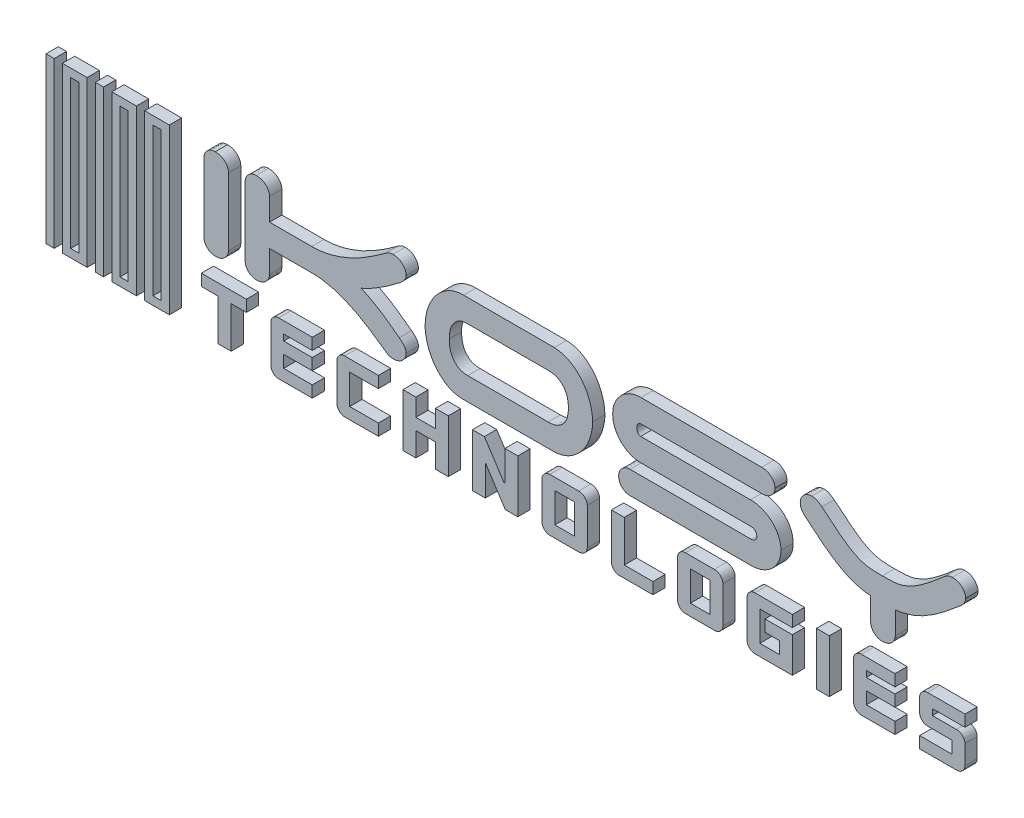
from build123d import *

# Parameters (mm, degrees)
SYMBOL_SKETCH_W        = 1.675
SYMBOL_SKETCH_H        = 33.5
SYMBOL_EXTRUDE_DEPTH   = 2.5
SYMBOL_SKETCH_W_2      = 5.025
SYMBOL_SKETCH_H_2      = 30.15
SYMBOL_EXTRUDE_2_DEPTH = 2.5
SYMBOL_EXTRUDE_3_DEPTH = 2.5
SYMBOL_EXTRUDE_4_DEPTH = 2.5
SYMBOL_EXTRUDE_5_DEPTH = 2.5
TEXT_EXTRUDE_DEPTH     = 2.5
TEXT_EXTRUDE_2_DEPTH   = 2.5
TEXT_EXTRUDE_3_DEPTH   = 2.5
TEXT_EXTRUDE_4_DEPTH   = 2.5
TEXT_EXTRUDE_5_DEPTH   = 2.5
TEXT_EXTRUDE_6_DEPTH   = 2.5
TEXT_EXTRUDE_7_DEPTH   = 2.5
TEXT_EXTRUDE_8_DEPTH   = 2.5
TEXT_EXTRUDE_9_DEPTH   = 2.5
TEXT_EXTRUDE_10_DEPTH  = 2.5
TEXT_SKETCH_W          = 3.996794872
TEXT_SKETCH_H          = 6.064102564
TEXT_EXTRUDE_11_DEPTH  = 2.5
TEXT_EXTRUDE_12_DEPTH  = 2.5
TEXT_EXTRUDE_13_DEPTH  = 2.5
TEXT_EXTRUDE_14_DEPTH  = 2.5
TEXT_SKETCH_W_2        = 2.618589744
TEXT_SKETCH_H_2        = 10.75
TEXT_EXTRUDE_15_DEPTH  = 2.5
TEXT_EXTRUDE_16_DEPTH  = 2.5
TEXT_EXTRUDE_17_DEPTH  = 2.5


with BuildPart() as part:
    # Symbol Sketch → Symbol Extrude (new body)
    with BuildSketch(Plane.XY):
        with Locations((0.8375, 16.75)):
            Rectangle(SYMBOL_SKETCH_W, SYMBOL_SKETCH_H)
    extrude(amount=SYMBOL_EXTRUDE_DEPTH)


with BuildPart() as body_2:
    # Symbol Sketch → Symbol Extrude 2 (new body)
    with BuildSketch(Plane.XY):
        with Locations((5.8625, 16.75)):
            Rectangle(SYMBOL_SKETCH_W_2, SYMBOL_SKETCH_H)
        with Locations((5.8625, 16.75)):
            Rectangle(SYMBOL_SKETCH_W, SYMBOL_SKETCH_H_2, mode=Mode.SUBTRACT)
    extrude(amount=SYMBOL_EXTRUDE_2_DEPTH)


with BuildPart() as body_3:
    # Symbol Sketch → Symbol Extrude 3 (new body)
    with BuildSketch(Plane.XY):
        with Locations((10.8875, 16.75)):
            Rectangle(SYMBOL_SKETCH_W, SYMBOL_SKETCH_H)
    extrude(amount=SYMBOL_EXTRUDE_3_DEPTH)


with BuildPart() as body_4:
    # Symbol Sketch → Symbol Extrude 4 (new body)
    with BuildSketch(Plane.XY):
        with Locations((15.9125, 16.75)):
            Rectangle(SYMBOL_SKETCH_W_2, SYMBOL_SKETCH_H)
        with Locations((15.9125, 16.75)):
            Rectangle(SYMBOL_SKETCH_W, SYMBOL_SKETCH_H_2, mode=Mode.SUBTRACT)
    extrude(amount=SYMBOL_EXTRUDE_4_DEPTH)


with BuildPart() as body_5:
    # Symbol Sketch → Symbol Extrude 5 (new body)
    with BuildSketch(Plane.XY):
        with Locations((22.6125, 16.75)):
            Rectangle(SYMBOL_SKETCH_W_2, SYMBOL_SKETCH_H)
        with Locations((22.6125, 16.75)):
            Rectangle(SYMBOL_SKETCH_W, SYMBOL_SKETCH_H_2, mode=Mode.SUBTRACT)
    extrude(amount=SYMBOL_EXTRUDE_5_DEPTH)


with BuildPart() as body_6:
    # Text Sketch → Text Extrude (new body)
    with BuildSketch(Plane.XY):
        with BuildLine():
            add(Edge.make_bspline(
                [(37.182145172, 17.358903111), (37.172614042, 17.216464941), (37.153507078, 16.930920527), (37.006814698, 16.516172232), (36.772865011, 16.120067652), (36.453812647, 15.752559297), (36.06468528, 15.423409809), (35.590116527, 15.196153881), (35.054726107, 15.055542545), (34.675469577, 15.03902523), (34.47750324, 15.030403435)],
                knots=[0, 0, 0, 0, 0.862232898, 1.728509904, 2.637124992, 3.638458358, 4.667549052, 5.703761565, 6.801397276, 8, 8, 8, 8], degree=3))
            add(Edge.make_bspline(
                [(34.47750324, 15.030403435), (34.31944086, 15.037950422), (34.011904891, 15.052634309), (33.568705895, 15.182300503), (33.171021184, 15.404395227), (32.811828224, 15.693228094), (32.522995357, 16.052421054), (32.300900632, 16.450105765), (32.171234439, 16.893304761), (32.156550552, 17.20084073), (32.149003564, 17.358903111)],
                knots=[0, 0, 0, 0, 1.033498853, 2.010839451, 2.990522858, 4, 5.009477142, 5.989160549, 6.966501147, 8, 8, 8, 8], degree=3))
            Line((32.149003564, 17.358903111), (32.149003564, 31.126903759))
            add(Edge.make_bspline(
                [(32.149003564, 31.126903759), (32.157033893, 31.282851206), (32.172853275, 31.590060602), (32.298078277, 32.032913745), (32.524796911, 32.428618665), (32.81347736, 32.786410354), (33.169018501, 33.081830551), (33.570514074, 33.304574569), (34.014159418, 33.431885187), (34.321492837, 33.447484712), (34.47750324, 33.455403435)],
                knots=[0, 0, 0, 0, 1.021036462, 2.011395514, 2.980149812, 3.990138669, 5.008424466, 5.988604486, 6.978963538, 8, 8, 8, 8], degree=3))
            add(Edge.make_bspline(
                [(34.47750324, 33.455403435), (34.673350927, 33.446429128), (35.050366674, 33.429153176), (35.586176139, 33.291547398), (36.057589653, 33.053363866), (36.453813659, 32.729883836), (36.772620655, 32.359428844), (37.006883894, 31.963745241), (37.152788255, 31.55078682), (37.172420665, 31.267315427), (37.182145172, 31.126903759)],
                knots=[0, 0, 0, 0, 1.187948747, 2.286855633, 3.329671233, 4.369332619, 5.371825634, 6.281492993, 7.148773238, 8, 8, 8, 8], degree=3))
            Line((37.182145172, 31.126903759), (37.182145172, 17.358903111))
        make_face()
    extrude(amount=TEXT_EXTRUDE_DEPTH)


with BuildPart() as body_7:
    # Text Sketch → Text Extrude 2 (new body)
    with BuildSketch(Plane.XY):
        with BuildLine():
            Line((45.552802981, 26.571403111), (54.144369734, 26.571403111))
            add(Edge.make_bspline(
                [(54.144369734, 26.571403111), (54.486859765, 26.579352598), (55.16914667, 26.595189063), (56.187147227, 26.690022319), (57.189333875, 26.859879412), (58.514327124, 27.164788101), (60.147453942, 27.698179783), (62.071811851, 28.488227135), (63.93251169, 29.435053601), (65.711254445, 30.500703399), (67.412352307, 31.628130344), (68.509760547, 32.415193234), (69.052738172, 32.804617628)],
                knots=[0, 0, 0, 0, 0.625370962, 1.245824342, 1.864700964, 2.479950729, 3.726807079, 4.996086198, 6.27499779, 7.534434493, 8.780083059, 10, 10, 10, 10], degree=3))
            add(Edge.make_bspline(
                [(69.052738172, 32.804617628), (69.180924828, 32.905013993), (69.428529436, 33.098939036), (69.838818131, 33.301070223), (70.253097409, 33.429576829), (70.532544055, 33.446857248), (70.670746922, 33.455403435)],
                knots=[0, 0, 0, 0, 1.095900439, 2.116834999, 3.068663713, 4, 4, 4, 4], degree=3))
            add(Edge.make_bspline(
                [(70.670746922, 33.455403435), (70.866647718, 33.446658037), (71.241838803, 33.429908768), (71.775130836, 33.290324316), (72.244740749, 33.053375031), (72.641616114, 32.730176752), (72.958710831, 32.357563257), (73.201237776, 31.965573734), (73.345684871, 31.550581006), (73.365549381, 31.267247251), (73.375388853, 31.126903759)],
                knots=[0, 0, 0, 0, 1.188770155, 2.27674401, 3.320280665, 4.360660926, 5.363847116, 6.280304729, 7.148184656, 8, 8, 8, 8], degree=3))
            add(Edge.make_bspline(
                [(73.375388853, 31.126903759), (73.37089662, 31.030915742), (73.361970624, 30.840189062), (73.286709068, 30.561340692), (73.164457735, 30.293885233), (72.931849333, 29.94501161), (72.542002315, 29.521037526), (72.170230435, 29.232578593), (71.972318535, 29.079018146)],
                knots=[0, 0, 0, 0, 0.669693301, 1.330670049, 2.00266867, 2.716108566, 4.251827991, 6, 6, 6, 6], degree=3))
            add(Edge.make_bspline(
                [(71.972318535, 29.079018146), (71.634884641, 28.819126035), (70.986192283, 28.31950217), (70.021608464, 27.606770011), (69.065549149, 26.944452694), (68.086164671, 26.300465206), (67.044824961, 25.683270782), (66.159618942, 25.170630259), (65.450425207, 24.8004343), (64.963060142, 24.561872254), (64.520039702, 24.377123432), (64.235053276, 24.281281235), (64.103183733, 24.236932923)],
                knots=[0, 0, 0, 0, 1.377873125, 2.648861836, 3.879417678, 5.140173149, 6.439784966, 7.794983305, 8.44869275, 9.027502601, 9.550003875, 10, 10, 10, 10], degree=3))
            add(Edge.make_bspline(
                [(64.103183733, 24.236932923), (64.426346781, 24.115830526), (65.094021845, 23.865625402), (66.067574581, 23.35696038), (67.062537349, 22.791904628), (68.06629702, 22.188119935), (69.0489301, 21.550166516), (70.007726675, 20.872192439), (70.976462382, 20.156053887), (71.628687404, 19.658437208), (71.966348023, 19.400818211)],
                knots=[0, 0, 0, 0, 0.89323937, 1.845488394, 2.840530647, 3.858234817, 4.879263654, 5.87478663, 6.899764902, 8, 8, 8, 8], degree=3))
            add(Edge.make_bspline(
                [(71.966348023, 19.400818211), (72.166585933, 19.245454257), (72.543003808, 18.95339283), (72.932133926, 18.524661686), (73.171708237, 18.181767786), (73.286316603, 17.915397621), (73.361701204, 17.641714314), (73.370838187, 17.452927967), (73.375388853, 17.358903111)],
                knots=[0, 0, 0, 0, 1.769110466, 3.325667981, 4.028039365, 4.68216811, 5.343655115, 6, 6, 6, 6], degree=3))
            add(Edge.make_bspline(
                [(73.375388853, 17.358903111), (73.365854065, 17.216469479), (73.34673977, 16.930934162), (73.200103478, 16.516116278), (72.965922621, 16.120298508), (72.646824317, 15.750413997), (72.25242558, 15.425252855), (71.77765472, 15.195819855), (71.243861358, 15.056153822), (70.866680419, 15.039206848), (70.670746922, 15.030403435)],
                knots=[0, 0, 0, 0, 0.862519697, 1.729084847, 2.638002162, 3.639668596, 4.678472755, 5.715029937, 6.813030747, 8, 8, 8, 8], degree=3))
            add(Edge.make_bspline(
                [(70.670746922, 15.030403435), (70.532519538, 15.038899076), (70.253023319, 15.05607729), (69.841696478, 15.18458098), (69.434489931, 15.380427022), (69.190846876, 15.570711597), (69.064679196, 15.669248218)],
                knots=[0, 0, 0, 0, 0.939973017, 1.900628496, 2.912865253, 4, 4, 4, 4], degree=3))
            add(Edge.make_bspline(
                [(69.064679196, 15.669248218), (68.509996443, 16.068968023), (67.393710081, 16.873394992), (65.667835584, 18.016151854), (63.89340991, 19.091271258), (62.356363003, 19.877937945), (61.098353336, 20.427962037), (60.142058009, 20.797968314), (59.173292424, 21.12913809), (58.189140829, 21.40894719), (57.193794985, 21.639448918), (56.186095774, 21.797303185), (55.169730959, 21.90665734), (54.486969658, 21.915791087), (54.144369734, 21.920374271)],
                knots=[0, 0, 0, 0, 1.495432356, 3.00952343, 4.526603086, 6.031585771, 6.782144813, 7.529147792, 8.273927562, 9.020803678, 9.766397276, 10.507145663, 11.250906896, 12, 12, 12, 12], degree=3))
            Line((54.144369734, 21.920374271), (45.552802981, 21.920374271))
            Line((45.552802981, 21.920374271), (45.552802981, 17.358903111))
            add(Edge.make_bspline(
                [(45.552802981, 17.358903111), (45.543271477, 17.216465609), (45.524163762, 16.930922534), (45.377477128, 16.516163996), (45.143503758, 16.12010163), (44.824550559, 15.752416518), (44.436407817, 15.425116475), (43.968809015, 15.197115476), (43.445443175, 15.055875135), (43.075994082, 15.039114346), (42.883984122, 15.030403435)],
                knots=[0, 0, 0, 0, 0.869868558, 1.743817038, 2.660478533, 3.670679389, 4.708883383, 5.743368767, 6.827184362, 8, 8, 8, 8], degree=3))
            add(Edge.make_bspline(
                [(42.883984122, 15.030403435), (42.725921741, 15.037950422), (42.418385772, 15.052634309), (41.975186776, 15.182300503), (41.577502065, 15.404395227), (41.218309105, 15.693228094), (40.929476238, 16.052421054), (40.707381514, 16.450105765), (40.57771532, 16.893304761), (40.563031433, 17.20084073), (40.555484446, 17.358903111)],
                knots=[0, 0, 0, 0, 1.033498853, 2.010839451, 2.990522858, 4, 5.009477142, 5.989160549, 6.966501147, 8, 8, 8, 8], degree=3))
            Line((40.555484446, 17.358903111), (40.555484446, 31.126903759))
            add(Edge.make_bspline(
                [(40.555484446, 31.126903759), (40.563515377, 31.282850394), (40.579335946, 31.59005819), (40.704552313, 32.032922971), (40.931303311, 32.42858427), (41.219858014, 32.786545445), (41.574518307, 33.080210928), (41.967503069, 33.301946414), (42.396284047, 33.432256679), (42.692064386, 33.447610471), (42.842190538, 33.455403435)],
                knots=[0, 0, 0, 0, 1.03238026, 2.033742283, 3.013259521, 4.034469437, 5.064068473, 6.043585711, 7.007003139, 8, 8, 8, 8], degree=3))
            add(Edge.make_bspline(
                [(42.842190538, 33.455403435), (43.038034287, 33.446426788), (43.415042456, 33.429146333), (43.950904615, 33.291571865), (44.422131128, 33.053277221), (44.819036365, 32.730201967), (45.136123497, 32.357557234), (45.378652257, 31.965575188), (45.523098915, 31.550580659), (45.542963481, 31.267247136), (45.552802981, 31.126903759)],
                knots=[0, 0, 0, 0, 1.187035174, 2.285096964, 3.327110603, 4.365972454, 5.367694518, 6.282814583, 7.14942786, 8, 8, 8, 8], degree=3))
            Line((45.552802981, 31.126903759), (45.552802981, 26.571403111))
        make_face()
    extrude(amount=TEXT_EXTRUDE_2_DEPTH)


with BuildPart() as body_8:
    # Text Sketch → Text Extrude 3 (new body)
    with BuildSketch(Plane.XY):
        with BuildLine():
            add(Edge.make_bspline(
                [(111.353815619, 24.242903435), (111.348994555, 23.989778597), (111.33923799, 23.477520473), (111.228605779, 22.705852479), (111.069846709, 21.920927302), (110.842341935, 21.133126299), (110.55966344, 20.35213342), (110.207211048, 19.598063398), (109.783786331, 18.877342161), (109.304542305, 18.187440879), (108.760051664, 17.538777697), (108.147582965, 16.945018374), (107.468407849, 16.407346485), (106.73395845, 15.920657099), (105.928457415, 15.521781024), (105.055362662, 15.232853389), (104.115937433, 15.065943879), (103.469420637, 15.042438605), (103.138391121, 15.030403435)],
                knots=[0, 0, 0, 0, 0.887562666, 1.79619349, 2.730230654, 3.696171481, 4.670456872, 5.642035631, 6.612182846, 7.600186341, 8.58641134, 9.579043665, 10.587854658, 11.622157229, 12.665262734, 13.731876165, 14.838675282, 16, 16, 16, 16], degree=3))
            Line((103.138391121, 15.030403435), (84.659656513, 15.030403435))
            add(Edge.make_bspline(
                [(84.659656513, 15.030403435), (84.370080298, 15.055027634), (83.803167744, 15.10323521), (82.983046752, 15.29698083), (82.217087831, 15.592736658), (81.505416533, 15.982920524), (80.85142467, 16.454360111), (80.236876696, 16.972404366), (79.683625026, 17.554728526), (79.179101432, 18.183241115), (78.733864736, 18.859069759), (78.338187379, 19.568602332), (78.00500702, 20.313106591), (77.722482484, 21.07984952), (77.510066763, 21.868017553), (77.356108133, 22.660147191), (77.254026262, 23.452144023), (77.243537332, 23.979895365), (77.23831011, 24.242903435)],
                knots=[0, 0, 0, 0, 1.071895832, 2.098484516, 3.098701618, 4.095024705, 5.085859565, 6.070929021, 7.058325083, 8.046349754, 9.042889575, 10.042755757, 11.042486936, 12.051303591, 13.056635549, 14.052389487, 15.029396535, 16, 16, 16, 16], degree=3))
            add(Edge.make_bspline(
                [(77.23831011, 24.242903435), (77.246453928, 24.509799624), (77.26285149, 25.047194639), (77.357152996, 25.853067742), (77.530494058, 26.657524075), (77.754264709, 27.461021805), (78.041391065, 28.250776499), (78.406734369, 29.004886724), (78.815846808, 29.732279712), (79.294021656, 30.417508049), (79.829761356, 31.056781891), (80.423896669, 31.638337532), (81.070278769, 32.160544264), (81.770884139, 32.615050122), (82.519626885, 32.999506534), (83.330933658, 33.257743163), (84.184941379, 33.426835259), (84.772259541, 33.445758207), (85.071621841, 33.455403435)],
                knots=[0, 0, 0, 0, 0.957572403, 1.928070379, 2.905345163, 3.906550234, 4.91841359, 5.914694441, 6.909080783, 7.909165367, 8.907311603, 9.896765544, 10.886811641, 11.882811104, 12.888485635, 13.895350359, 14.927237742, 16, 16, 16, 16], degree=3))
            Line((85.071621841, 33.455403435), (103.562297472, 33.449432923))
            add(Edge.make_bspline(
                [(103.562297472, 33.449432923), (103.881834833, 33.423539771), (104.504881866, 33.373052242), (105.404007255, 33.16528616), (106.241004153, 32.858985534), (106.999552828, 32.430566938), (107.695481955, 31.94159588), (108.334492434, 31.401229995), (108.908739995, 30.807898158), (109.421435647, 30.168222415), (109.875003555, 29.492207648), (110.272685041, 28.787236437), (110.59793102, 28.048696915), (110.873728828, 27.293325569), (111.086156998, 26.526113324), (111.244136509, 25.76066809), (111.335848702, 24.999435914), (111.347854751, 24.493897545), (111.353815619, 24.242903435)],
                knots=[0, 0, 0, 0, 1.15756904, 2.257075526, 3.324770562, 4.368045022, 5.395925654, 6.396323121, 7.388434129, 8.376048353, 9.355769955, 10.328466472, 11.297804901, 12.26956978, 13.233097401, 14.172774794, 15.092803254, 16, 16, 16, 16], degree=3))
        make_face()
        with BuildLine():
            add(Edge.make_bspline(
                [(102.290578419, 19.681432275), (102.493897065, 19.687081139), (102.882489858, 19.697877533), (103.43802075, 19.781466029), (103.936814716, 19.919738736), (104.373442017, 20.128626023), (104.752358622, 20.377693027), (105.099516883, 20.637082516), (105.3926992, 20.933937178), (105.729176496, 21.357821947), (106.058926063, 21.955236526), (106.279282317, 22.735352924), (106.412093607, 23.501905951), (106.431120372, 24.005602281), (106.440084251, 24.242903435)],
                knots=[0, 0, 0, 0, 1.046644794, 2.000400019, 2.885908836, 3.701969816, 4.480954947, 5.218948154, 5.92916188, 6.622234248, 8.002950174, 9.406752558, 10.778270606, 12, 12, 12, 12], degree=3))
            add(Edge.make_bspline(
                [(106.440084251, 24.242903435), (106.431274628, 24.480249801), (106.412648178, 24.982078326), (106.277885498, 25.745942577), (106.061647688, 26.524420867), (105.723946787, 27.116050185), (105.395204484, 27.548008061), (105.09133427, 27.840086005), (104.748840838, 28.109046486), (104.365885942, 28.358473533), (103.927889717, 28.563462087), (103.430461639, 28.705602039), (102.878403665, 28.787344971), (102.491871168, 28.798543032), (102.290578419, 28.804374595)],
                knots=[0, 0, 0, 0, 1.222567146, 2.584910299, 3.989675285, 5.362363695, 6.06397828, 6.781967681, 7.526778103, 8.306297391, 9.132203488, 10.00847181, 10.962881034, 12, 12, 12, 12], degree=3))
            Line((102.290578419, 28.804374595), (85.925405055, 28.804374595))
            add(Edge.make_bspline(
                [(85.925405055, 28.804374595), (85.747937462, 28.800752617), (85.407052429, 28.793795413), (84.924107929, 28.715025615), (84.490000806, 28.592278181), (83.994603668, 28.352511717), (83.456936937, 27.9519452), (82.931172218, 27.350128412), (82.547137346, 26.631220865), (82.30673027, 25.842580808), (82.178941369, 25.037289462), (82.160815651, 24.502015283), (82.152041478, 24.242903435)],
                knots=[0, 0, 0, 0, 0.794200639, 1.525524215, 2.185566194, 2.807611374, 3.980821995, 5.16243582, 6.359119684, 7.602475229, 8.839422673, 10, 10, 10, 10], degree=3))
            add(Edge.make_bspline(
                [(82.152041478, 24.242903435), (82.160672361, 23.981755998), (82.178497016, 23.442429643), (82.308136414, 22.63447879), (82.538564784, 21.840088861), (82.930517926, 21.125383855), (83.458600434, 20.530468803), (83.986550278, 20.125748608), (84.482707834, 19.8924747), (84.916311803, 19.771535944), (85.403033754, 19.691567634), (85.745934168, 19.684914476), (85.925405055, 19.681432275)],
                knots=[0, 0, 0, 0, 1.168189698, 2.412566253, 3.651898492, 4.851533932, 6.025141351, 7.189898139, 7.799403787, 8.467261891, 9.19777913, 10, 10, 10, 10], degree=3))
            Line((85.925405055, 19.681432275), (102.290578419, 19.681432275))
        make_face(mode=Mode.SUBTRACT)
    extrude(amount=TEXT_EXTRUDE_3_DEPTH)


with BuildPart() as body_9:
    # Text Sketch → Text Extrude 4 (new body)
    with BuildSketch(Plane.XY):
        with BuildLine():
            add(Edge.make_bspline(
                [(121.217101426, 21.920374271), (121.017826032, 21.926573655), (120.623494254, 21.93884117), (120.042509249, 22.022488617), (119.485047021, 22.16752527), (118.950181195, 22.364296202), (118.447637637, 22.61658068), (117.970921592, 22.901670476), (117.535465013, 23.235000758), (117.124989484, 23.595776911), (116.764213331, 24.00625244), (116.430883049, 24.441709019), (116.145793252, 24.918425065), (115.893508775, 25.420968622), (115.696737843, 25.955834449), (115.55170119, 26.513296677), (115.468053743, 27.094281681), (115.455786228, 27.488613459), (115.449586844, 27.687888853)],
                knots=[0, 0, 0, 0, 1.055198062, 2.088055732, 3.10027589, 4.100630988, 5.099819621, 6.074018954, 7.037268981, 8, 8.962731019, 9.925981046, 10.900180379, 11.899369012, 12.89972411, 13.911944268, 14.944801938, 16, 16, 16, 16], degree=3))
            add(Edge.make_bspline(
                [(115.449586844, 27.687888853), (115.455793792, 27.887167824), (115.468076278, 28.281506681), (115.551339136, 28.860528318), (115.696155917, 29.417058901), (115.900978508, 29.947506801), (116.151267048, 30.451594027), (116.437073415, 30.927939183), (116.769793903, 31.363978979), (117.133188602, 31.773490725), (117.539668408, 32.143366911), (117.982857304, 32.471330903), (118.457558828, 32.761175179), (118.966635677, 33.003921897), (119.498103026, 33.208143698), (120.054512167, 33.35300862), (120.629405186, 33.437012652), (121.019802299, 33.449229352), (121.217101426, 33.455403435)],
                knots=[0, 0, 0, 0, 1.056069126, 2.089779418, 3.092625705, 4.097522181, 5.097535642, 6.072539174, 7.036584362, 8.000110114, 8.970710769, 9.943200813, 10.918204345, 11.913590283, 12.928346752, 13.931193039, 14.954465097, 16, 16, 16, 16], degree=3))
            Line((121.217101426, 33.455403435), (145.803669799, 33.455403435))
            add(Edge.make_bspline(
                [(145.803669799, 33.455403435), (145.999513548, 33.446426788), (146.376521717, 33.429146333), (146.912383876, 33.291571865), (147.383610389, 33.053277221), (147.780515626, 32.730201967), (148.097602758, 32.357557234), (148.340131519, 31.965575188), (148.484578177, 31.550580659), (148.504442742, 31.267247136), (148.514282242, 31.126903759)],
                knots=[0, 0, 0, 0, 1.187035174, 2.285096964, 3.327110603, 4.365972454, 5.367694518, 6.282814583, 7.14942786, 8, 8, 8, 8], degree=3))
            add(Edge.make_bspline(
                [(148.514282242, 31.126903759), (148.504558795, 30.986489983), (148.484928523, 30.703014335), (148.339007628, 30.290088822), (148.104812725, 29.894269206), (147.78571872, 29.524385466), (147.391318469, 29.199223258), (146.916549111, 28.969793784), (146.380817234, 28.829607633), (146.001610265, 28.813028604), (145.803669799, 28.804374595)],
                knots=[0, 0, 0, 0, 0.850520932, 1.717082035, 2.625995105, 3.627656861, 4.666456168, 5.70300851, 6.801004192, 8, 8, 8, 8], degree=3))
            Line((145.803669799, 28.804374595), (121.13948477, 28.804374595))
            add(Edge.make_bspline(
                [(121.13948477, 28.804374595), (121.063693239, 28.787232398), (120.87716047, 28.745043232), (120.679143648, 28.572383553), (120.512655636, 28.388264225), (120.425018573, 28.188359985), (120.371513826, 27.951504313), (120.366175554, 27.779796523), (120.363318211, 27.687888853)],
                knots=[0, 0, 0, 0, 0.929705688, 2.288126067, 3.074503345, 3.925707183, 4.889721779, 6, 6, 6, 6], degree=3))
            add(Edge.make_bspline(
                [(120.363318211, 27.687888853), (120.366153737, 27.599925916), (120.371500042, 27.434074209), (120.427186883, 27.201978296), (120.512629401, 27.000174212), (120.676348787, 26.808642274), (120.878647155, 26.638903106), (121.063879252, 26.590968434), (121.13948477, 26.571403111)],
                knots=[0, 0, 0, 0, 1.066464062, 2.010788751, 2.887353709, 3.695542847, 5.059398025, 6, 6, 6, 6], degree=3))
            Line((121.13948477, 26.571403111), (143.534875243, 26.571403111))
            add(Edge.make_bspline(
                [(143.534875243, 26.571403111), (143.756126286, 26.566172652), (144.19477772, 26.555802766), (144.841380853, 26.457561896), (145.465157032, 26.295924503), (146.061017763, 26.073018293), (146.62304302, 25.808547849), (147.14309044, 25.50100522), (147.615254622, 25.155130974), (148.039814034, 24.771663946), (148.420686172, 24.356374178), (148.751954281, 23.907479368), (149.050968925, 23.433915297), (149.2907417, 22.926914162), (149.49054355, 22.405214304), (149.62771894, 21.866203761), (149.71373728, 21.318134257), (149.726088556, 20.947491275), (149.732266688, 20.762094945)],
                knots=[0, 0, 0, 0, 1.125524374, 2.23146012, 3.319860629, 4.399933111, 5.464745038, 6.47755185, 7.470303123, 8.438566666, 9.385019312, 10.333150884, 11.274821239, 12.230766696, 13.182786281, 14.113937299, 15.056587825, 16, 16, 16, 16], degree=3))
            add(Edge.make_bspline(
                [(149.732266688, 20.762094945), (149.725923937, 20.576742819), (149.713243556, 20.206188208), (149.629605245, 19.656955325), (149.483407915, 19.121767761), (149.287020814, 18.604077115), (149.041235887, 18.106108959), (148.748297006, 17.635006737), (148.410952166, 17.18891237), (148.029724109, 16.772795673), (147.607654595, 16.387604283), (147.132159818, 16.053375097), (146.621510524, 15.744487552), (146.060088344, 15.494245829), (145.469996632, 15.278470321), (144.845188683, 15.14167754), (144.198543357, 15.046281326), (143.758139085, 15.035744898), (143.534875243, 15.030403435)],
                knots=[0, 0, 0, 0, 0.947658347, 1.894551617, 2.832491261, 3.779275183, 4.721235255, 5.667143943, 6.611409382, 7.57649714, 8.549118708, 9.52614791, 10.54351323, 11.595303979, 12.663746289, 13.749776913, 14.859244828, 16, 16, 16, 16], degree=3))
            Line((143.534875243, 15.030403435), (118.990100454, 15.030403435))
            add(Edge.make_bspline(
                [(118.990100454, 15.030403435), (118.83404776, 15.038114315), (118.528545022, 15.053209824), (118.08727467, 15.182297149), (117.689588618, 15.404396157), (117.330396028, 15.693227841), (117.041563061, 16.05242112), (116.819468363, 16.450105748), (116.689802162, 16.893304766), (116.675118277, 17.200840732), (116.66757129, 17.358903111)],
                knots=[0, 0, 0, 0, 1.022177595, 2.001106468, 2.982381959, 3.993499602, 5.004617245, 5.985892735, 6.964821609, 8, 8, 8, 8], degree=3))
            add(Edge.make_bspline(
                [(116.66757129, 17.358903111), (116.675608371, 17.514842559), (116.691441055, 17.822036197), (116.816569286, 18.265003974), (117.04365064, 18.660279222), (117.330126494, 19.018745232), (117.689658444, 19.307403967), (118.087256362, 19.529547891), (118.528549831, 19.658623434), (118.834049386, 19.673720566), (118.990100454, 19.681432275)],
                knots=[0, 0, 0, 0, 1.023700639, 2.016643822, 2.987925878, 4.000550086, 5.013174293, 5.995911884, 6.976299361, 8, 8, 8, 8], degree=3))
            Line((118.990100454, 19.681432275), (143.702049579, 19.681432275))
            add(Edge.make_bspline(
                [(143.702049579, 19.681432275), (143.845308378, 19.695480381), (144.135343765, 19.72392155), (144.439737596, 19.943027008), (144.639034421, 20.155666708), (144.738466705, 20.34718427), (144.812474746, 20.547704917), (144.816489843, 20.689737111), (144.818535321, 20.762094945)],
                knots=[0, 0, 0, 0, 1.483557837, 3.00354516, 3.785710979, 4.522423995, 5.247253764, 6, 6, 6, 6], degree=3))
            add(Edge.make_bspline(
                [(144.818535321, 20.762094945), (144.813347173, 20.840084756), (144.803341951, 20.99048629), (144.742049242, 21.209432237), (144.631949002, 21.407762196), (144.483271931, 21.582857523), (144.312190937, 21.733687581), (144.121302125, 21.84234404), (143.914763601, 21.904847666), (143.774107867, 21.91511453), (143.702049579, 21.920374271)],
                knots=[0, 0, 0, 0, 1.052637569, 2.029987015, 3.039270143, 4.08779047, 5.115827877, 6.101623483, 7.027456916, 8, 8, 8, 8], degree=3))
            Line((143.702049579, 21.920374271), (121.217101426, 21.920374271))
        make_face()
    extrude(amount=TEXT_EXTRUDE_4_DEPTH)


with BuildPart() as body_10:
    # Text Sketch → Text Extrude 5 (new body)
    with BuildSketch(Plane.XY):
        with BuildLine():
            add(Edge.make_bspline(
                [(173.035174984, 17.358903111), (173.025640196, 17.216469478), (173.0065259, 16.930934159), (172.859889613, 16.516116288), (172.625708737, 16.120298463), (172.306610511, 15.750414184), (171.912211468, 15.425252131), (171.437441779, 15.195822615), (170.901709996, 15.055636476), (170.522503014, 15.039057445), (170.324562541, 15.030403435)],
                knots=[0, 0, 0, 0, 0.861224399, 1.726488175, 2.634040514, 3.634202684, 4.671446808, 5.70644733, 6.802799205, 8, 8, 8, 8], degree=3))
            add(Edge.make_bspline(
                [(170.324562541, 15.030403435), (170.168509847, 15.038114315), (169.863007109, 15.053209824), (169.421736757, 15.182297149), (169.024050705, 15.404396157), (168.664858115, 15.693227841), (168.376025148, 16.05242112), (168.15393045, 16.450105748), (168.024264249, 16.893304766), (168.009580363, 17.200840732), (168.002033377, 17.358903111)],
                knots=[0, 0, 0, 0, 1.022177595, 2.001106468, 2.982381959, 3.993499602, 5.004617245, 5.985892735, 6.964821609, 8, 8, 8, 8], degree=3))
            Line((168.002033377, 17.358903111), (168.002033377, 21.920374271))
            add(Edge.make_bspline(
                [(168.002033377, 21.920374271), (167.792760822, 21.924234631), (167.358690089, 21.932241745), (166.693951576, 22.026401774), (165.98853887, 22.147315269), (165.255219937, 22.334183228), (164.496085879, 22.574044372), (163.719376603, 22.865858209), (162.930287482, 23.219665537), (162.127625079, 23.636557884), (161.298511011, 24.108728965), (160.451357226, 24.654830958), (159.566106751, 25.253466698), (158.65517876, 25.924684194), (157.700120482, 26.663847072), (156.699447625, 27.477156146), (155.642084547, 28.360337465), (154.925658489, 28.980380854), (154.556440376, 29.29992709)],
                knots=[0, 0, 0, 0, 0.641398825, 1.330382084, 2.055978345, 2.836185825, 3.648952849, 4.496988013, 5.379557769, 6.299582378, 7.270216231, 8.304862195, 9.390111043, 10.547532482, 11.774599775, 13.093996411, 14.502358824, 16, 16, 16, 16], degree=3))
            add(Edge.make_bspline(
                [(154.556440376, 29.29992709), (154.439006949, 29.417957817), (154.197903315, 29.660287775), (153.907981861, 30.093712509), (153.697031447, 30.589995479), (153.672935578, 30.947696162), (153.660863577, 31.126903759)],
                knots=[0, 0, 0, 0, 0.953032214, 1.956679093, 2.976298768, 4, 4, 4, 4], degree=3))
            add(Edge.make_bspline(
                [(153.660863577, 31.126903759), (153.668893906, 31.282851206), (153.684713288, 31.590060602), (153.80993829, 32.032913745), (154.036656924, 32.428618665), (154.325337373, 32.786410354), (154.680878514, 33.081830551), (155.082374087, 33.304574569), (155.526019431, 33.431885187), (155.83335285, 33.447484712), (155.989363253, 33.455403435)],
                knots=[0, 0, 0, 0, 1.021036462, 2.011395514, 2.980149812, 3.990138669, 5.008424466, 5.988604486, 6.978963538, 8, 8, 8, 8], degree=3))
            add(Edge.make_bspline(
                [(155.989363253, 33.455403435), (156.187832621, 33.449933525), (156.548072053, 33.440005156), (156.972175862, 33.30121232), (157.26629083, 33.140651276), (157.508928188, 32.994562647), (157.780836701, 32.815999418), (157.971877452, 32.683661028), (158.073071938, 32.613561244)],
                knots=[0, 0, 0, 0, 1.550277569, 2.813890719, 3.449254088, 4.17735297, 5.034541965, 6, 6, 6, 6], degree=3))
            add(Edge.make_bspline(
                [(158.073071938, 32.613561244), (158.482045349, 32.260128564), (159.257722684, 31.589792275), (160.372311852, 30.657741649), (161.374057841, 29.855368451), (162.275918389, 29.176315012), (163.096766108, 28.597090968), (163.86431779, 28.116740563), (164.57927606, 27.709748785), (165.250940376, 27.382935749), (165.895843149, 27.130474893), (166.512143554, 26.924442588), (167.113612145, 26.779853955), (167.707209892, 26.689128272), (168.314063058, 26.641058114), (168.956736442, 26.596293988), (169.645749284, 26.573551995), (170.121553079, 26.572133125), (170.366356124, 26.571403111)],
                knots=[0, 0, 0, 0, 1.836146017, 3.482516976, 4.935327597, 6.195494878, 7.317033276, 8.346813987, 9.270068544, 10.110663513, 10.881484832, 11.621201485, 12.31645431, 12.980022201, 13.658809721, 14.383734916, 15.168424845, 16, 16, 16, 16], degree=3))
            add(Edge.make_bspline(
                [(170.366356124, 26.571403111), (170.623108675, 26.571924823), (171.118826281, 26.572932104), (171.83545423, 26.598139987), (172.49617539, 26.634705581), (173.11730106, 26.676016131), (173.720371073, 26.768587398), (174.334951806, 26.910989979), (174.966466722, 27.126208002), (175.631025619, 27.389019775), (176.329060199, 27.728678289), (177.067012835, 28.148140943), (177.849359752, 28.648072664), (178.532906471, 29.116472519), (179.106577477, 29.546873411), (179.580123331, 29.904684064), (180.083856503, 30.300632133), (180.614126392, 30.734362083), (181.18196383, 31.194540784), (181.770645886, 31.699369852), (182.395683531, 32.232269952), (182.819273708, 32.603123116), (183.035782566, 32.792676604)],
                knots=[0, 0, 0, 0, 1.057356201, 2.041460081, 2.952579034, 3.782999482, 4.603695654, 5.462550415, 6.377495452, 7.348542422, 8.404309042, 9.571413422, 10.842502825, 12.227097685, 12.982804895, 13.795894059, 14.67148133, 15.621299327, 16.617244161, 17.6814085, 18.81490264, 20, 20, 20, 20], degree=3))
            add(Edge.make_bspline(
                [(183.035782566, 32.792676604), (183.167881956, 32.895299245), (183.419804726, 33.091007794), (183.834862955, 33.293366879), (184.246999843, 33.431259762), (184.527361662, 33.447425128), (184.66573234, 33.455403435)],
                knots=[0, 0, 0, 0, 1.116180587, 2.128634399, 3.076400182, 4, 4, 4, 4], degree=3))
            add(Edge.make_bspline(
                [(184.66573234, 33.455403435), (184.861576089, 33.446426788), (185.238584257, 33.429146333), (185.774446416, 33.291571865), (186.24567293, 33.053277221), (186.642578166, 32.730201967), (186.959665298, 32.357557234), (187.202194059, 31.965575188), (187.346640717, 31.550580659), (187.366505283, 31.267247136), (187.376344783, 31.126903759)],
                knots=[0, 0, 0, 0, 1.187035174, 2.285096964, 3.327110603, 4.365972454, 5.367694518, 6.282814583, 7.14942786, 8, 8, 8, 8], degree=3))
            add(Edge.make_bspline(
                [(187.376344783, 31.126903759), (187.364715549, 30.973810257), (187.340436146, 30.654183114), (187.130819259, 30.18644629), (186.797446326, 29.722883595), (186.502401018, 29.44801289), (186.343446209, 29.29992709)],
                knots=[0, 0, 0, 0, 0.846631323, 1.767588747, 2.797294875, 4, 4, 4, 4], degree=3))
            add(Edge.make_bspline(
                [(186.343446209, 29.29992709), (185.999699879, 29.004744277), (185.323641622, 28.424197633), (184.317906281, 27.5795757), (183.324588339, 26.794338226), (182.361930297, 26.05141617), (181.418075082, 25.373551802), (180.508072074, 24.747142594), (179.613987456, 24.19941229), (178.749203755, 23.704631135), (177.898710578, 23.281332823), (177.065617155, 22.911935639), (176.240776845, 22.608950689), (175.443027531, 22.361815765), (174.702105733, 22.175164371), (174.053150446, 22.036867305), (173.509367899, 21.944649463), (173.180709121, 21.927824549), (173.035174984, 21.920374271)],
                knots=[0, 0, 0, 0, 1.405337354, 2.763927467, 4.073070632, 5.332368463, 6.535021961, 7.676977369, 8.757910683, 9.786166288, 10.766154311, 11.703149807, 12.611296932, 13.489908946, 14.292364098, 14.980007543, 15.548334831, 16, 16, 16, 16], degree=3))
            Line((173.035174984, 21.920374271), (173.035174984, 17.358903111))
        make_face()
    extrude(amount=TEXT_EXTRUDE_5_DEPTH)


with BuildPart() as body_11:
    # Text Sketch → Text Extrude 6 (new body)
    with BuildSketch(Plane.XY):
        Polygon((40.816446314, 8.269230769), (37.702564103, 8.269230769), (37.702564103, -0.137820513), (35.083974359, -0.137820513), (35.083974359, 8.269230769), (31.638461538, 8.269230769), (31.638461538, 10.612179487), (40.816446314, 10.612179487), align=None)
    extrude(amount=TEXT_EXTRUDE_6_DEPTH)


with BuildPart() as body_12:
    # Text Sketch → Text Extrude 7 (new body)
    with BuildSketch(Plane.XY):
        with BuildLine():
            Line((54.241973157, -0.137820513), (47.391862981, -0.137820513))
            add(Edge.make_bspline(
                [(47.391862981, -0.137820513), (47.337903849, -0.13706862), (47.231584766, -0.135587118), (47.075611592, -0.109109363), (46.924364237, -0.075283537), (46.780919239, -0.018046303), (46.641010057, 0.046526742), (46.507736019, 0.130326664), (46.38174288, 0.229513294), (46.261757549, 0.340718946), (46.151509135, 0.462338134), (46.05898053, 0.594366625), (45.97344583, 0.727913197), (45.911131143, 0.871345653), (45.857029782, 1.018883278), (45.822809295, 1.173233045), (45.796135829, 1.332789186), (45.794726288, 1.441251156), (45.79400641, 1.496644631)],
                knots=[0, 0, 0, 0, 1.018185487, 2.006195112, 2.983343043, 3.940706292, 4.917571715, 5.89245729, 6.90729392, 7.943926622, 8.981446471, 10.00170814, 10.988133445, 11.971569574, 12.949752669, 13.953284623, 14.95470571, 16, 16, 16, 16], degree=3))
            Line((45.79400641, 1.496644631), (45.79400641, 8.977714343))
            add(Edge.make_bspline(
                [(45.79400641, 8.977714343), (45.794829941, 9.032373888), (45.796463511, 9.140797484), (45.822182671, 9.299837501), (45.857697224, 9.453810616), (45.910247875, 9.601636601), (45.977364144, 9.743237432), (46.056792807, 9.880910703), (46.15484425, 10.009293568), (46.264446342, 10.131473283), (46.382404851, 10.24524272), (46.511324769, 10.34130665), (46.641978472, 10.427641024), (46.781998882, 10.49334942), (46.925362087, 10.548760441), (47.076220038, 10.583874075), (47.231605807, 10.609870553), (47.337910932, 10.611402163), (47.391862981, 10.612179487)],
                knots=[0, 0, 0, 0, 1.032407883, 2.047901701, 3.038877924, 4.01769447, 5.007461449, 5.999181091, 7.017211835, 8.055403561, 9.1019911, 10.109195778, 11.091957287, 12.057221282, 13.027910023, 13.992505718, 14.981155157, 16, 16, 16, 16], degree=3))
            Line((47.391862981, 10.612179487), (54.241973157, 10.612179487))
            Line((54.241973157, 10.612179487), (54.241973157, 8.269230769))
            Line((54.241973157, 8.269230769), (48.412596154, 8.269230769))
            Line((48.412596154, 8.269230769), (48.412596154, 7.028846154))
            Line((48.412596154, 7.028846154), (54.241973157, 7.028846154))
            Line((54.241973157, 7.028846154), (54.241973157, 4.685897436))
            Line((54.241973157, 4.685897436), (48.412596154, 4.685897436))
            Line((48.412596154, 4.685897436), (48.412596154, 2.205128205))
            Line((48.412596154, 2.205128205), (54.241973157, 2.205128205))
            Line((54.241973157, 2.205128205), (54.241973157, -0.137820513))
        make_face()
    extrude(amount=TEXT_EXTRUDE_7_DEPTH)


with BuildPart() as body_13:
    # Text Sketch → Text Extrude 8 (new body)
    with BuildSketch(Plane.XY):
        with BuildLine():
            Line((67.708415465, -0.137820513), (60.858305288, -0.137820513))
            add(Edge.make_bspline(
                [(60.858305288, -0.137820513), (60.804346156, -0.13706862), (60.698027074, -0.135587118), (60.5420539, -0.109109363), (60.390806545, -0.075283537), (60.247361546, -0.018046303), (60.107452364, 0.046526742), (59.974178326, 0.130326664), (59.848185188, 0.229513294), (59.728199857, 0.340718946), (59.617951442, 0.462338134), (59.525422837, 0.594366625), (59.439888138, 0.727913197), (59.37757345, 0.871345653), (59.32347209, 1.018883278), (59.289251602, 1.173233045), (59.262578137, 1.332789186), (59.261168596, 1.441251156), (59.260448718, 1.496644631)],
                knots=[0, 0, 0, 0, 1.018185487, 2.006195112, 2.983343043, 3.940706292, 4.917571715, 5.89245729, 6.90729392, 7.943926622, 8.981446471, 10.00170814, 10.988133445, 11.971569574, 12.949752669, 13.953284623, 14.95470571, 16, 16, 16, 16], degree=3))
            Line((59.260448718, 1.496644631), (59.260448718, 8.977714343))
            add(Edge.make_bspline(
                [(59.260448718, 8.977714343), (59.261272249, 9.032373888), (59.262905819, 9.140797484), (59.288624978, 9.299837501), (59.324139532, 9.453810616), (59.376690183, 9.601636601), (59.443806452, 9.743237432), (59.523235114, 9.880910703), (59.621286557, 10.009293568), (59.73088865, 10.131473283), (59.848847159, 10.24524272), (59.977767077, 10.34130665), (60.108420779, 10.427641024), (60.24844119, 10.49334942), (60.391804395, 10.548760441), (60.542662346, 10.583874075), (60.698048114, 10.609870553), (60.80435324, 10.611402163), (60.858305288, 10.612179487)],
                knots=[0, 0, 0, 0, 1.032407883, 2.047901701, 3.038877924, 4.01769447, 5.007461449, 5.999181091, 7.017211835, 8.055403561, 9.1019911, 10.109195778, 11.091957287, 12.057221282, 13.027910023, 13.992505718, 14.981155157, 16, 16, 16, 16], degree=3))
            Line((60.858305288, 10.612179487), (67.708415465, 10.612179487))
            Line((67.708415465, 10.612179487), (67.708415465, 8.269230769))
            Line((67.708415465, 8.269230769), (61.879038462, 8.269230769))
            Line((61.879038462, 8.269230769), (61.879038462, 2.205128205))
            Line((61.879038462, 2.205128205), (67.708415465, 2.205128205))
            Line((67.708415465, 2.205128205), (67.708415465, -0.137820513))
        make_face()
    extrude(amount=TEXT_EXTRUDE_8_DEPTH)


with BuildPart() as body_14:
    # Text Sketch → Text Extrude 9 (new body)
    with BuildSketch(Plane.XY):
        Polygon((81.960865385, -0.137820513), (79.342275641, -0.137820513), (79.342275641, 4.685897436), (75.345480769, 4.685897436), (75.345480769, -0.137820513), (72.726891026, -0.137820513), (72.726891026, 10.612179487), (75.345480769, 10.612179487), (75.345480769, 7.028846154), (79.342275641, 7.028846154), (79.342275641, 10.612179487), (81.960865385, 10.612179487), align=None)
    extrude(amount=TEXT_EXTRUDE_9_DEPTH)


with BuildPart() as body_15:
    # Text Sketch → Text Extrude 10 (new body)
    with BuildSketch(Plane.XY):
        Polygon((96.116410256, -0.137820513), (93.562423878, -0.137820513), (89.501025641, 6.135166266), (89.501025641, -0.137820513), (86.882435897, -0.137820513), (86.882435897, 10.612179487), (89.315829327, 10.612179487), (93.459058494, 4.270282452), (93.497820513, 10.612179487), (96.116410256, 10.612179487), align=None)
    extrude(amount=TEXT_EXTRUDE_10_DEPTH)


with BuildPart() as body_16:
    # Text Sketch → Text Extrude 11 (new body)
    with BuildSketch(Plane.XY):
        with BuildLine():
            add(Edge.make_bspline(
                [(110.271955128, 1.496644631), (110.26992512, 1.444911229), (110.265904526, 1.342449051), (110.245127892, 1.19041326), (110.204710471, 1.043032414), (110.152470243, 0.898292323), (110.078657, 0.760253129), (109.995013168, 0.622908347), (109.8940379, 0.490107189), (109.77753291, 0.364629125), (109.653000315, 0.244935524), (109.513128563, 0.145544898), (109.370485206, 0.055021732), (109.215916933, -0.013402901), (109.055764188, -0.070203078), (108.88581947, -0.108260851), (108.708547074, -0.132705228), (108.587326709, -0.136092954), (108.525510817, -0.137820513)],
                knots=[0, 0, 0, 0, 0.936205362, 1.854230249, 2.767468929, 3.695900317, 4.630754408, 5.592711331, 6.602789045, 7.641172185, 8.688364586, 9.719253805, 10.739046823, 11.738303312, 12.768865473, 13.808141008, 14.882269356, 16, 16, 16, 16], degree=3))
            Line((108.525510817, -0.137820513), (102.646604567, -0.137820513))
            add(Edge.make_bspline(
                [(102.646604567, -0.137820513), (102.592723352, -0.135773708), (102.485983097, -0.131718929), (102.328179924, -0.111272544), (102.177374795, -0.070932127), (102.030676889, -0.02005516), (101.891808044, 0.050123107), (101.756185799, 0.131502137), (101.630037086, 0.231758877), (101.509964234, 0.343459568), (101.398425957, 0.463662863), (101.303640226, 0.594884104), (101.220781218, 0.730341737), (101.154410567, 0.872840354), (101.101620722, 1.020516496), (101.066171033, 1.174530245), (101.040434265, 1.333559232), (101.038803092, 1.441984329), (101.037980769, 1.496644631)],
                knots=[0, 0, 0, 0, 1.016089297, 2.012902422, 2.990714531, 3.953531091, 4.933680119, 5.917463654, 6.929582427, 7.963438898, 9.007249655, 10.013837931, 11.0091811, 11.995658539, 12.971221939, 13.958904604, 14.971023376, 16, 16, 16, 16], degree=3))
            Line((101.037980769, 1.496644631), (101.037980769, 8.977714343))
            add(Edge.make_bspline(
                [(101.037980769, 8.977714343), (101.038803086, 9.032374652), (101.040434248, 9.140799765), (101.066171098, 9.299828643), (101.101620484, 9.453842792), (101.154411447, 9.601517457), (101.220777877, 9.744021648), (101.303652874, 9.879458169), (101.398377426, 10.010760192), (101.510844884, 10.13139471), (101.63052931, 10.244579085), (101.759818401, 10.342083873), (101.892105927, 10.427008414), (102.032377033, 10.493417208), (102.176433355, 10.549114523), (102.328842341, 10.58381683), (102.485644761, 10.609771287), (102.592655207, 10.611372324), (102.646604567, 10.612179487)],
                knots=[0, 0, 0, 0, 1.028811898, 2.040768644, 3.028293193, 4.003700418, 4.990019934, 5.985203762, 6.991630896, 8.035274552, 9.088081957, 10.091778435, 11.08254002, 12.044441899, 13.011749629, 13.986124627, 14.984703901, 16, 16, 16, 16], degree=3))
            Line((102.646604567, 10.612179487), (108.525510817, 10.612179487))
            add(Edge.make_bspline(
                [(108.525510817, 10.612179487), (108.587327066, 10.610455009), (108.708548131, 10.607073324), (108.885815487, 10.582585464), (109.055115895, 10.544833733), (109.215495476, 10.487484686), (109.368663959, 10.416722116), (109.51436235, 10.330228251), (109.650161914, 10.226074763), (109.775620014, 10.107904735), (109.89132893, 9.982304529), (109.992833991, 9.850424897), (110.080322743, 9.715023886), (110.148012119, 9.57367572), (110.206041725, 9.431431317), (110.244801548, 9.283811129), (110.265988181, 9.131944423), (110.269953187, 9.029459321), (110.271955128, 8.977714343)],
                knots=[0, 0, 0, 0, 1.118395262, 2.193162302, 3.233055805, 4.251965692, 5.2690521, 6.282731452, 7.311612712, 8.359427787, 9.398428364, 10.398785236, 11.368214715, 12.30938, 13.230885495, 14.1446672, 15.063237957, 16, 16, 16, 16], degree=3))
            Line((110.271955128, 8.977714343), (110.271955128, 1.496644631))
        make_face()
        with Locations((105.654967949, 5.237179487)):
            Rectangle(TEXT_SKETCH_W, TEXT_SKETCH_H, mode=Mode.SUBTRACT)
    extrude(amount=TEXT_EXTRUDE_11_DEPTH)


with BuildPart() as body_17:
    # Text Sketch → Text Extrude 12 (new body)
    with BuildSketch(Plane.XY):
        with BuildLine():
            Line((123.641492388, -0.137820513), (116.791382212, -0.137820513))
            add(Edge.make_bspline(
                [(116.791382212, -0.137820513), (116.73742308, -0.13706862), (116.631103997, -0.135587118), (116.475130823, -0.109109363), (116.323883468, -0.075283537), (116.18043847, -0.018046303), (116.040529287, 0.046526742), (115.907255249, 0.130326664), (115.781262111, 0.229513294), (115.66127678, 0.340718946), (115.551028365, 0.462338134), (115.45849976, 0.594366625), (115.372965061, 0.727913197), (115.310650373, 0.871345653), (115.256549013, 1.018883278), (115.222328525, 1.173233045), (115.19565506, 1.332789186), (115.194245519, 1.441251156), (115.193525641, 1.496644631)],
                knots=[0, 0, 0, 0, 1.018185487, 2.006195112, 2.983343043, 3.940706292, 4.917571715, 5.89245729, 6.90729392, 7.943926622, 8.981446471, 10.00170814, 10.988133445, 11.971569574, 12.949752669, 13.953284623, 14.95470571, 16, 16, 16, 16], degree=3))
            Line((115.193525641, 1.496644631), (115.193525641, 10.612179487))
            Line((115.193525641, 10.612179487), (117.812115385, 10.612179487))
            Line((117.812115385, 10.612179487), (117.812115385, 2.205128205))
            Line((117.812115385, 2.205128205), (123.641492388, 2.205128205))
            Line((123.641492388, 2.205128205), (123.641492388, -0.137820513))
        make_face()
    extrude(amount=TEXT_EXTRUDE_12_DEPTH)


with BuildPart() as body_18:
    # Text Sketch → Text Extrude 13 (new body)
    with BuildSketch(Plane.XY):
        with BuildLine():
            add(Edge.make_bspline(
                [(137.893942308, 1.496644631), (137.8919123, 1.444911229), (137.887891705, 1.342449051), (137.867115071, 1.19041326), (137.826697651, 1.043032414), (137.774457422, 0.898292323), (137.700644179, 0.760253129), (137.617000347, 0.622908347), (137.516025079, 0.490107189), (137.39952009, 0.364629125), (137.274987495, 0.244935524), (137.135115743, 0.145544898), (136.992472386, 0.055021732), (136.837904112, -0.013402901), (136.677751368, -0.070203078), (136.507806649, -0.108260851), (136.330534254, -0.132705228), (136.209313888, -0.136092954), (136.147497997, -0.137820513)],
                knots=[0, 0, 0, 0, 0.936205362, 1.854230249, 2.767468929, 3.695900317, 4.630754408, 5.592711331, 6.602789045, 7.641172185, 8.688364586, 9.719253805, 10.739046823, 11.738303312, 12.768865473, 13.808141008, 14.882269356, 16, 16, 16, 16], degree=3))
            Line((136.147497997, -0.137820513), (130.268591747, -0.137820513))
            add(Edge.make_bspline(
                [(130.268591747, -0.137820513), (130.214710531, -0.135773708), (130.107970277, -0.131718929), (129.950167103, -0.111272544), (129.799361975, -0.070932127), (129.652664069, -0.02005516), (129.513795224, 0.050123107), (129.378172978, 0.131502137), (129.252024266, 0.231758877), (129.131951414, 0.343459568), (129.020413136, 0.463662863), (128.925627405, 0.594884104), (128.842768398, 0.730341737), (128.776397746, 0.872840354), (128.723607902, 1.020516496), (128.688158212, 1.174530245), (128.662421445, 1.333559232), (128.660790271, 1.441984329), (128.659967949, 1.496644631)],
                knots=[0, 0, 0, 0, 1.016089297, 2.012902422, 2.990714531, 3.953531091, 4.933680119, 5.917463654, 6.929582427, 7.963438898, 9.007249655, 10.013837931, 11.0091811, 11.995658539, 12.971221939, 13.958904604, 14.971023376, 16, 16, 16, 16], degree=3))
            Line((128.659967949, 1.496644631), (128.659967949, 8.977714343))
            add(Edge.make_bspline(
                [(128.659967949, 8.977714343), (128.660790266, 9.032374652), (128.662421428, 9.140799765), (128.688158278, 9.299828643), (128.723607664, 9.453842792), (128.776398626, 9.601517457), (128.842765057, 9.744021648), (128.925640054, 9.879458169), (129.020364606, 10.010760192), (129.132832064, 10.13139471), (129.25251649, 10.244579085), (129.381805581, 10.342083873), (129.514093107, 10.427008414), (129.654364212, 10.493417208), (129.798420535, 10.549114523), (129.950829521, 10.58381683), (130.107631941, 10.609771287), (130.214642387, 10.611372324), (130.268591747, 10.612179487)],
                knots=[0, 0, 0, 0, 1.028811898, 2.040768644, 3.028293193, 4.003700418, 4.990019934, 5.985203762, 6.991630896, 8.035274552, 9.088081957, 10.091778435, 11.08254002, 12.044441899, 13.011749629, 13.986124627, 14.984703901, 16, 16, 16, 16], degree=3))
            Line((130.268591747, 10.612179487), (136.147497997, 10.612179487))
            add(Edge.make_bspline(
                [(136.147497997, 10.612179487), (136.209314245, 10.610455009), (136.330535311, 10.607073324), (136.507802666, 10.582585464), (136.677103074, 10.544833733), (136.837482655, 10.487484686), (136.990651139, 10.416722116), (137.13634953, 10.330228251), (137.272149093, 10.226074763), (137.397607194, 10.107904735), (137.513316109, 9.982304529), (137.614821171, 9.850424897), (137.702309923, 9.715023886), (137.769999299, 9.57367572), (137.828028905, 9.431431317), (137.866788728, 9.283811129), (137.88797536, 9.131944423), (137.891940366, 9.029459321), (137.893942308, 8.977714343)],
                knots=[0, 0, 0, 0, 1.118395262, 2.193162302, 3.233055805, 4.251965692, 5.2690521, 6.282731452, 7.311612712, 8.359427787, 9.398428364, 10.398785236, 11.368214715, 12.30938, 13.230885495, 14.1446672, 15.063237957, 16, 16, 16, 16], degree=3))
            Line((137.893942308, 8.977714343), (137.893942308, 1.496644631))
        make_face()
        with Locations((133.276955128, 5.237179487)):
            Rectangle(TEXT_SKETCH_W, TEXT_SKETCH_H, mode=Mode.SUBTRACT)
    extrude(amount=TEXT_EXTRUDE_13_DEPTH)


with BuildPart() as body_19:
    # Text Sketch → Text Extrude 14 (new body)
    with BuildSketch(Plane.XY):
        with BuildLine():
            Line((152.049487179, -0.137820513), (144.424136619, -0.137820513))
            add(Edge.make_bspline(
                [(144.424136619, -0.137820513), (144.370255403, -0.135773708), (144.263515149, -0.131718929), (144.105711975, -0.111272544), (143.954906847, -0.070932127), (143.80820894, -0.02005516), (143.669340095, 0.050123107), (143.53371785, 0.131502137), (143.407569138, 0.231758877), (143.287496286, 0.343459568), (143.175958008, 0.463662863), (143.081172277, 0.594884104), (142.998313269, 0.730341737), (142.931942618, 0.872840354), (142.879152773, 1.020516496), (142.843703084, 1.174530245), (142.817966316, 1.333559232), (142.816335143, 1.441984329), (142.815512821, 1.496644631)],
                knots=[0, 0, 0, 0, 1.016089297, 2.012902422, 2.990714531, 3.953531091, 4.933680119, 5.917463654, 6.929582427, 7.963438898, 9.007249655, 10.013837931, 11.0091811, 11.995658539, 12.971221939, 13.958904604, 14.971023376, 16, 16, 16, 16], degree=3))
            Line((142.815512821, 1.496644631), (142.815512821, 8.977714343))
            add(Edge.make_bspline(
                [(142.815512821, 8.977714343), (142.816335138, 9.032374652), (142.8179663, 9.140799765), (142.843703149, 9.299828643), (142.879152536, 9.453842792), (142.931943498, 9.601517457), (142.998309929, 9.744021648), (143.081184925, 9.879458169), (143.175909477, 10.010760192), (143.288376935, 10.13139471), (143.408061362, 10.244579085), (143.537350453, 10.342083873), (143.669637978, 10.427008414), (143.809909084, 10.493417208), (143.953965406, 10.549114523), (144.106374392, 10.58381683), (144.263176813, 10.609771287), (144.370187258, 10.611372324), (144.424136619, 10.612179487)],
                knots=[0, 0, 0, 0, 1.028811898, 2.040768644, 3.028293193, 4.003700418, 4.990019934, 5.985203762, 6.991630896, 8.035274552, 9.088081957, 10.091778435, 11.08254002, 12.044441899, 13.011749629, 13.986124627, 14.984703901, 16, 16, 16, 16], degree=3))
            Line((144.424136619, 10.612179487), (152.049487179, 10.612179487))
            Line((152.049487179, 10.612179487), (152.049487179, 8.269230769))
            Line((152.049487179, 8.269230769), (145.434102564, 8.269230769))
            Line((145.434102564, 8.269230769), (145.434102564, 2.205128205))
            Line((145.434102564, 2.205128205), (149.430897436, 2.205128205))
            Line((149.430897436, 2.205128205), (149.430897436, 4.685897436))
            Line((149.430897436, 4.685897436), (146.46775641, 4.685897436))
            Line((146.46775641, 4.685897436), (146.46775641, 7.028846154))
            Line((146.46775641, 7.028846154), (152.049487179, 7.028846154))
            Line((152.049487179, 7.028846154), (152.049487179, -0.137820513))
        make_face()
    extrude(amount=TEXT_EXTRUDE_14_DEPTH)


with BuildPart() as body_20:
    # Text Sketch → Text Extrude 15 (new body)
    with BuildSketch(Plane.XY):
        with Locations((158.280352564, 5.237179487)):
            Rectangle(TEXT_SKETCH_W_2, TEXT_SKETCH_H_2)
    extrude(amount=TEXT_EXTRUDE_15_DEPTH)


with BuildPart() as body_21:
    # Text Sketch → Text Extrude 16 (new body)
    with BuildSketch(Plane.XY):
        with BuildLine():
            Line((172.959184696, -0.137820513), (166.109074519, -0.137820513))
            add(Edge.make_bspline(
                [(166.109074519, -0.137820513), (166.055115387, -0.13706862), (165.948796305, -0.135587118), (165.79282313, -0.109109363), (165.641575775, -0.075283537), (165.498130777, -0.018046303), (165.358221595, 0.046526742), (165.224947557, 0.130326664), (165.098954418, 0.229513294), (164.978969088, 0.340718946), (164.868720673, 0.462338134), (164.776192068, 0.594366625), (164.690657369, 0.727913197), (164.628342681, 0.871345653), (164.574241321, 1.018883278), (164.540020833, 1.173233045), (164.513347368, 1.332789186), (164.511937827, 1.441251156), (164.511217949, 1.496644631)],
                knots=[0, 0, 0, 0, 1.018185487, 2.006195112, 2.983343043, 3.940706292, 4.917571715, 5.89245729, 6.90729392, 7.943926622, 8.981446471, 10.00170814, 10.988133445, 11.971569574, 12.949752669, 13.953284623, 14.95470571, 16, 16, 16, 16], degree=3))
            Line((164.511217949, 1.496644631), (164.511217949, 8.977714343))
            add(Edge.make_bspline(
                [(164.511217949, 8.977714343), (164.51204148, 9.032373888), (164.51367505, 9.140797484), (164.539394209, 9.299837501), (164.574908763, 9.453810616), (164.627459414, 9.601636601), (164.694575683, 9.743237432), (164.774004345, 9.880910703), (164.872055788, 10.009293568), (164.98165788, 10.131473283), (165.09961639, 10.24524272), (165.228536308, 10.34130665), (165.35919001, 10.427641024), (165.499210421, 10.49334942), (165.642573626, 10.548760441), (165.793431576, 10.583874075), (165.948817345, 10.609870553), (166.055122471, 10.611402163), (166.109074519, 10.612179487)],
                knots=[0, 0, 0, 0, 1.032407883, 2.047901701, 3.038877924, 4.01769447, 5.007461449, 5.999181091, 7.017211835, 8.055403561, 9.1019911, 10.109195778, 11.091957287, 12.057221282, 13.027910023, 13.992505718, 14.981155157, 16, 16, 16, 16], degree=3))
            Line((166.109074519, 10.612179487), (172.959184696, 10.612179487))
            Line((172.959184696, 10.612179487), (172.959184696, 8.269230769))
            Line((172.959184696, 8.269230769), (167.129807692, 8.269230769))
            Line((167.129807692, 8.269230769), (167.129807692, 7.028846154))
            Line((167.129807692, 7.028846154), (172.959184696, 7.028846154))
            Line((172.959184696, 7.028846154), (172.959184696, 4.685897436))
            Line((172.959184696, 4.685897436), (167.129807692, 4.685897436))
            Line((167.129807692, 4.685897436), (167.129807692, 2.205128205))
            Line((167.129807692, 2.205128205), (172.959184696, 2.205128205))
            Line((172.959184696, 2.205128205), (172.959184696, -0.137820513))
        make_face()
    extrude(amount=TEXT_EXTRUDE_16_DEPTH)


with BuildPart() as body_22:
    # Text Sketch → Text Extrude 17 (new body)
    with BuildSketch(Plane.XY):
        with BuildLine():
            add(Edge.make_bspline(
                [(187.211634615, 1.498798077), (187.209631589, 1.447056465), (187.205664434, 1.344578028), (187.184397594, 1.191972889), (187.145344654, 1.044141397), (187.090993516, 0.899520189), (187.019063245, 0.760610611), (186.934580474, 0.622962021), (186.833749013, 0.490092057), (186.717203739, 0.364633267), (186.592682091, 0.244934429), (186.452807448, 0.145545187), (186.310164851, 0.055021657), (186.155596377, -0.013402881), (185.995443687, -0.070203084), (185.825498953, -0.108260849), (185.648226562, -0.132705229), (185.527006196, -0.136092954), (185.465190304, -0.137820513)],
                knots=[0, 0, 0, 0, 0.935505954, 1.852845014, 2.777948597, 3.693543054, 4.639247997, 5.600486274, 6.609809393, 7.64741679, 8.693826868, 9.723945944, 10.742977108, 11.741487086, 12.771279347, 13.809778474, 14.883104376, 16, 16, 16, 16], degree=3))
            Line((185.465190304, -0.137820513), (177.977660256, -0.137820513))
            Line((177.977660256, -0.137820513), (177.977660256, 2.205128205))
            Line((177.977660256, 2.205128205), (184.593044872, 2.205128205))
            Line((184.593044872, 2.205128205), (184.593044872, 4.685897436))
            Line((184.593044872, 4.685897436), (179.586284054, 4.685897436))
            add(Edge.make_bspline(
                [(179.586284054, 4.685897436), (179.531608655, 4.686620254), (179.424575264, 4.688035253), (179.267141515, 4.714656341), (179.115032702, 4.749102121), (178.968968171, 4.802483838), (178.828898311, 4.868118385), (178.696179573, 4.95272027), (178.567048378, 5.0480094), (178.447444776, 5.160154199), (178.338496786, 5.282364765), (178.241136505, 5.410387939), (178.160396688, 5.546577609), (178.094002372, 5.687882338), (178.041301863, 5.83563426), (178.006093429, 5.988950359), (177.97985682, 6.147913731), (177.978402834, 6.256362212), (177.977660256, 6.311748798)],
                knots=[0, 0, 0, 0, 1.03045821, 2.017240613, 3.006345407, 3.970548293, 4.946200336, 5.91987499, 6.935983212, 7.971328296, 9.007559426, 10.023667648, 11.001856175, 11.989754007, 12.966722086, 13.955826879, 14.956004086, 16, 16, 16, 16], degree=3))
            Line((177.977660256, 6.311748798), (177.977660256, 8.986328125))
            add(Edge.make_bspline(
                [(177.977660256, 8.986328125), (177.978484024, 9.040987832), (177.980118062, 9.149411749), (178.00583378, 9.30844941), (178.041361011, 9.462431204), (178.093647254, 9.609612497), (178.16046333, 9.750561494), (178.243950529, 9.884099248), (178.338002584, 10.015088413), (178.449774121, 10.13504933), (178.56898829, 10.24713616), (178.696607907, 10.344749408), (178.831376088, 10.426583983), (178.9704393, 10.496273178), (179.11667008, 10.54835968), (179.268434704, 10.584039747), (179.425346682, 10.60971389), (179.532342213, 10.611353086), (179.586284054, 10.612179487)],
                knots=[0, 0, 0, 0, 1.031170123, 2.045446459, 3.035234595, 4.012877632, 4.989203724, 5.97508442, 6.983818468, 8.029854347, 9.06591472, 10.071911853, 11.057792549, 12.040030988, 13.004900013, 13.981508457, 14.982376656, 16, 16, 16, 16], degree=3))
            Line((179.586284054, 10.612179487), (187.211634615, 10.612179487))
            Line((187.211634615, 10.612179487), (187.211634615, 8.269230769))
            Line((187.211634615, 8.269230769), (180.59625, 8.269230769))
            Line((180.59625, 8.269230769), (180.59625, 7.028846154))
            Line((180.59625, 7.028846154), (185.465190304, 7.028846154))
            add(Edge.make_bspline(
                [(185.465190304, 7.028846154), (185.527006556, 7.027121678), (185.648227628, 7.023739998), (185.825494938, 6.999252102), (185.994795513, 6.961500503), (186.155174484, 6.904150975), (186.308345229, 6.833390186), (186.454035167, 6.746889667), (186.58986691, 6.642761511), (186.715202739, 6.524495232), (186.831748667, 6.398829462), (186.931934099, 6.265181478), (187.019371026, 6.129972462), (187.088777515, 5.989383212), (187.145186597, 5.846444947), (187.18457781, 5.698363699), (187.205642861, 5.546447558), (187.209624351, 5.443969158), (187.211634615, 5.392227564)],
                knots=[0, 0, 0, 0, 1.117642036, 2.191685233, 3.230878379, 4.249102043, 5.265503455, 6.278500105, 7.306688426, 8.35379781, 9.392098632, 10.402096273, 11.370872853, 12.299775077, 13.232750462, 14.145916745, 15.063868855, 16, 16, 16, 16], degree=3))
            Line((187.211634615, 5.392227564), (187.211634615, 1.498798077))
        make_face()
    extrude(amount=TEXT_EXTRUDE_17_DEPTH)


solid = Compound([part.part, body_2.part, body_3.part, body_4.part, body_5.part, body_6.part, body_7.part, body_8.part, body_9.part, body_10.part, body_11.part, body_12.part, body_13.part, body_14.part, body_15.part, body_16.part, body_17.part, body_18.part, body_19.part, body_20.part, body_21.part, body_22.part])
